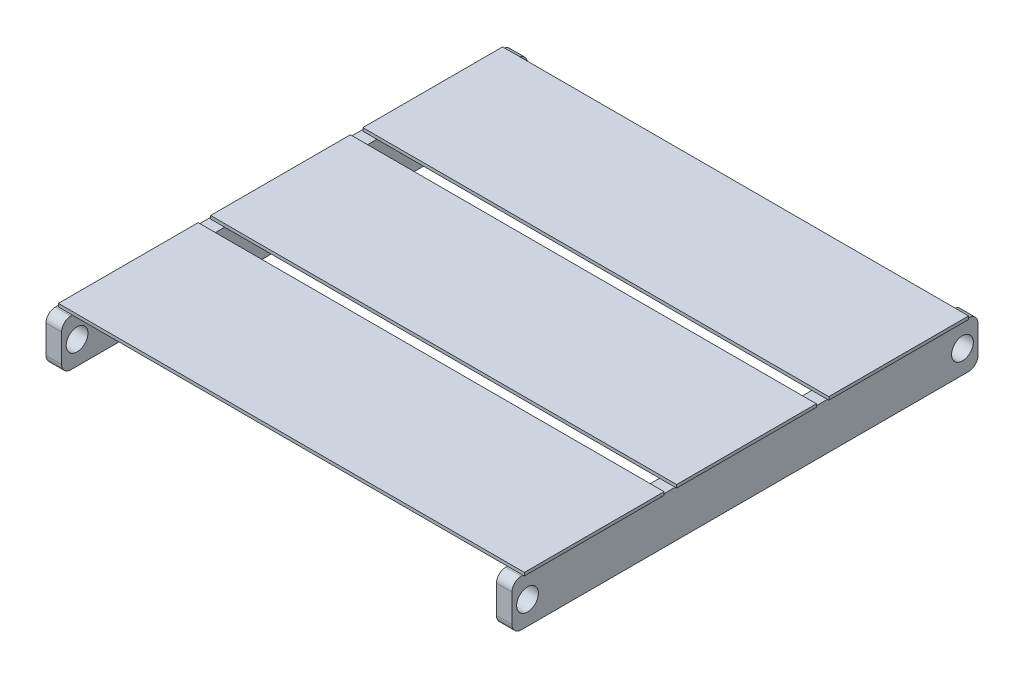
from build123d import *

# Parameters (mm, degrees)
BOSS_EXTRUDE1_DEPTH = 50
SKETCH2_W           = 1500
SKETCH2_H           = 450
BOSS_EXTRUDE2_DEPTH = 10
LPATTERN1_COUNT     = 2
LPATTERN1_PITCH     = 1450
LPATTERN2_COUNT     = 3
LPATTERN2_PITCH     = 490
CUT_EXTRUDE1_REACH  = 1685.38
SKETCH3_R           = 35


with BuildPart() as part:
    # Sketch1 → Boss-Extrude1 (new body)
    with BuildSketch(Plane(origin=(0, 0, 0), x_dir=(0, 0, -1), z_dir=(1, 0, 0))):
        with BuildLine():
            Line((-720, -75), (720, -75))
            ThreePointArc((720, -75), (741.213203436, -66.213203436), (750, -45))
            Line((750, -45), (750, 45))
            ThreePointArc((750, 45), (741.213203436, 66.213203436), (720, 75))
            Line((720, 75), (-720, 75))
            ThreePointArc((-720, 75), (-741.213203436, 66.213203436), (-750, 45))
            Line((-750, 45), (-750, -45))
            ThreePointArc((-750, -45), (-741.213203436, -66.213203436), (-720, -75))
        make_face()
    boss_extrude1 = extrude(amount=BOSS_EXTRUDE1_DEPTH)

    # Sketch2 → Boss-Extrude2 (add)
    with BuildSketch(Plane(origin=(0, 75, 0), x_dir=(1, 0, 0), z_dir=(0, 1, 0))):
        with Locations((754.674039581, 490.104243835)):
            Rectangle(SKETCH2_W, SKETCH2_H)
    boss_extrude2 = extrude(amount=BOSS_EXTRUDE2_DEPTH)

    # LPattern1: Boss-Extrude1 ×2
    with Locations(*[(i * LPATTERN1_PITCH, 0, 0) for i in range(1, LPATTERN1_COUNT)]):
        add(boss_extrude1)

    # LPattern2: Boss-Extrude2 ×3
    with Locations(*[(0, 0, i * LPATTERN2_PITCH) for i in range(1, LPATTERN2_COUNT)]):
        add(boss_extrude2)

    # Cut-Extrude1: up to this face of the body (flat: up to its plane)
    cut_extrude1_end = Plane(part.part.faces().sort_by_distance((1500, 0, 0))[0])
    # Sketch3 → Cut-Extrude1 (cut, up to the picked face)
    with BuildSketch(Plane.ZY, mode=Mode.PRIVATE) as cut_extrude1_sk1:
        with Locations((-700, 0)):
            Circle(SKETCH3_R)
    cut_extrude1_tool1 = split(extrude(cut_extrude1_sk1.sketch, amount=-CUT_EXTRUDE1_REACH, mode=Mode.PRIVATE), bisect_by=cut_extrude1_end, keep=Keep.BOTH, mode=Mode.PRIVATE)
    # Sketch3 → Cut-Extrude1 (cut, up to the picked face)
    with BuildSketch(Plane.ZY, mode=Mode.PRIVATE) as cut_extrude1_sk2:
        with Locations((700, 0)):
            Circle(SKETCH3_R)
    cut_extrude1_tool2 = split(extrude(cut_extrude1_sk2.sketch, amount=-CUT_EXTRUDE1_REACH, mode=Mode.PRIVATE), bisect_by=cut_extrude1_end, keep=Keep.BOTH, mode=Mode.PRIVATE)
    add(cut_extrude1_tool1.solids().sort_by(Axis((0, 0, -700), (1, 0, 0)))[0], mode=Mode.SUBTRACT)
    add(cut_extrude1_tool2.solids().sort_by(Axis((0, 0, 700), (1, 0, 0)))[0], mode=Mode.SUBTRACT)


solid = part.part
